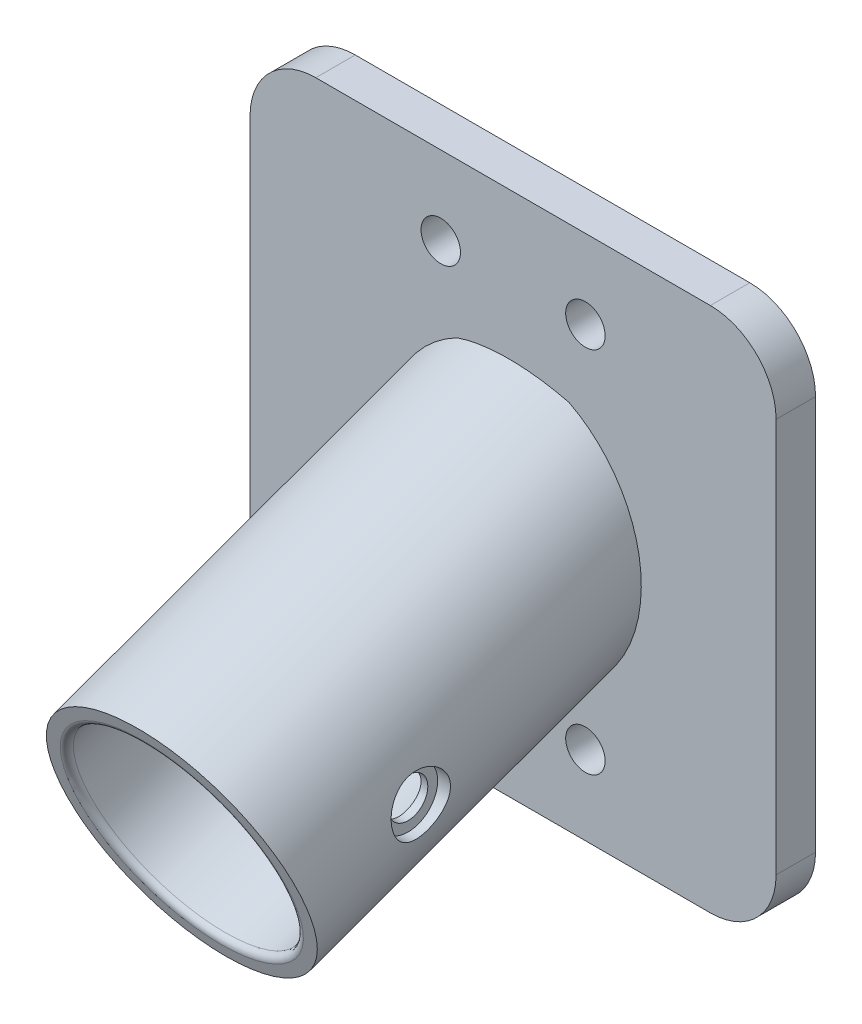
from build123d import *

# Parameters (mm, degrees)
EXTRUDE_1_DEPTH          = 3
CUT_EXTRUDE_2_DEPTH      = 29.442925307
CUT_EXTRUDE_2_DEPTH_BACK = 29.442925307
SKETCH_2_R               = 1.5
SKETCH_3_R               = 9.75
SKETCH_3_R_2             = 8.25
EXTRUDE_2_DEPTH          = 30
SKETCH_4_W               = 10.093928953
SKETCH_4_H               = 39.979180772
CUT_EXTRUDE_3_DEPTH      = 12.5
CUT_EXTRUDE_4_DEPTH      = 43.353932229
CUT_EXTRUDE_4_DEPTH_BACK = 43.353932229
SKETCH_5_R               = 1.5
SKETCH_6_R               = 2.25
CUT_EXTRUDE_5_DEPTH      = 1
CUT_EXTRUDE_6_DEPTH      = 1
FILLET_1_R               = 0.5


with BuildPart() as part:
    # 草圖1 → 填料-伸長1 (new body)
    with BuildSketch(Plane.XY):
        with BuildLine():
            Line((-15, 20), (15, 20))
            ThreePointArc((15, 20), (18.535533906, 18.535533906), (20, 15))
            Line((20, 15), (20, -15))
            ThreePointArc((20, -15), (18.535533906, -18.535533906), (15, -20))
            Line((15, -20), (-15, -20))
            ThreePointArc((-15, -20), (-18.535533906, -18.535533906), (-20, -15))
            Line((-20, -15), (-20, 15))
            ThreePointArc((-20, 15), (-18.535533906, 18.535533906), (-15, 20))
        make_face()
    extrude(amount=EXTRUDE_1_DEPTH)

    # 草圖2 → 除料-伸長2 (cut, two sides: drawn at the far end of the back side and taken through both)
    with BuildSketch(Plane.XY.offset(-CUT_EXTRUDE_2_DEPTH_BACK)):
        with Locations((-5.5, 14)):
            Circle(SKETCH_2_R)
        with Locations((5.5, 14)):
            Circle(SKETCH_2_R)
        with Locations((5.5, -14)):
            Circle(SKETCH_2_R)
        with Locations((-5.5, -14)):
            Circle(SKETCH_2_R)
    extrude(amount=CUT_EXTRUDE_2_DEPTH + CUT_EXTRUDE_2_DEPTH_BACK, mode=Mode.SUBTRACT)

    # 草圖3 → 填料-伸長2 (add)
    with BuildSketch(Plane(origin=(0, 0, 0), x_dir=(1, 0, 0), z_dir=(0, -0.34202014332566943, 0.9396926207859081))):
        Circle(SKETCH_3_R)
        Circle(SKETCH_3_R_2, mode=Mode.SUBTRACT)
    extrude(amount=EXTRUDE_2_DEPTH)

    # 草圖4 → 除料-伸長3 (cut, symmetric)
    with BuildSketch(Plane(origin=(0, 0, 0), x_dir=(0, 0, -1), z_dir=(1, 0, 0))):
        with Locations((5.046964477, 0.010409614)):
            Rectangle(SKETCH_4_W, SKETCH_4_H)
    extrude(amount=CUT_EXTRUDE_3_DEPTH, both=True, mode=Mode.SUBTRACT)

    # 草圖5 → 除料-伸長4 (cut, two sides: drawn at the far end of the back side and taken through both)
    with BuildSketch(Plane(origin=(0, 0, 0), x_dir=(0, 0, -1), z_dir=(1, 0, 0)).offset(-CUT_EXTRUDE_4_DEPTH_BACK)):
        with Locations((-19.733545037, -7.18242301)):
            Circle(SKETCH_5_R)
    extrude(amount=CUT_EXTRUDE_4_DEPTH + CUT_EXTRUDE_4_DEPTH_BACK, mode=Mode.SUBTRACT)

    # 草圖6 → 除料-伸長5 (cut)
    with BuildSketch(Plane(origin=(9.75, 0, 0), x_dir=(0, 0, -1), z_dir=(1, 0, 0))):
        with Locations((-19.733545037, -7.18242301)):
            Circle(SKETCH_6_R)
    extrude(amount=-CUT_EXTRUDE_5_DEPTH, mode=Mode.SUBTRACT)

    # 草圖7 → 除料-伸長6 (cut)
    with BuildSketch(Plane(origin=(-9.75, 0, 0), x_dir=(0, 0, -1), z_dir=(1, 0, 0))):
        Polygon((-17.301027227, -9.223547807), (-16.749620205, -6.09636319), (-19.182138015, -4.055238393), (-22.166062846, -5.141298213), (-22.717469868, -8.26848283), (-20.284952058, -10.309607627), align=None)
    extrude(amount=CUT_EXTRUDE_6_DEPTH, mode=Mode.SUBTRACT)

    # 圓角1
    fillet_1_edges = [part.edges().sort_by_distance(p)[0] for p in [
        (-8.25, -10.2606043, 28.190778624),
    ]]
    fillet(fillet_1_edges, radius=FILLET_1_R)


solid = part.part
